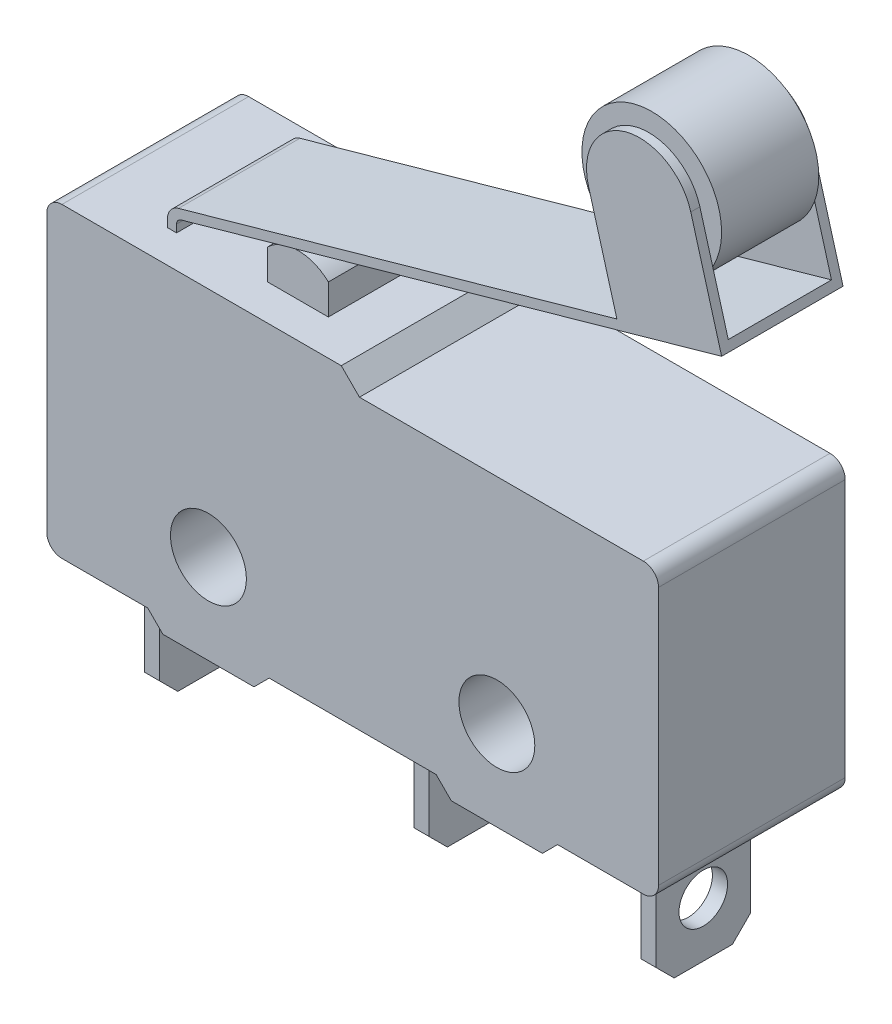
from build123d import *

# Parameters (mm, degrees)
CROQUIS1_W              = 20.15
CROQUIS1_H              = 9.5
SALIENTE_EXTRUIR1_DEPTH = 3.075
SALIENTE_EXTRUIR2_DEPTH = 6.15
CROQUIS2_3_R            = 1.25
CORTAR_EXTRUIR1_DEPTH   = 6.15
SALIENTE_EXTRUIR3_DEPTH = 6.15
CROQUIS4_W              = 0.5
CROQUIS4_H              = 3.12
SALIENTE_EXTRUIR4_DEPTH = 4
CROQUIS5_R              = 0.8
CORTAR_EXTRUIR2_DEPTH   = 21.6499546
REDONDEO1_R             = 0.5
CROQUIS6_W              = 2
CROQUIS6_H              = 1
SALIENTE_EXTRUIR5_DEPTH = 1.9
SALIENTE_EXTRUIR7_DEPTH = 2
SALIENTE_EXTRUIR8_DEPTH = 0.3
CROQUIS9_R              = 2.3
SALIENTE_EXTRUIR9_DEPTH = 1.6


with BuildPart() as part:
    # Croquis1 → Saliente-Extruir1 (new, symmetric)
    with BuildSketch(Plane.XY):
        Rectangle(CROQUIS1_W, CROQUIS1_H)
    extrude(amount=SALIENTE_EXTRUIR1_DEPTH, both=True)

    # Croquis2 → Saliente-Extruir2 (add)
    with BuildSketch(Plane.XY.offset(3.075)):
        Polygon((-2.75, -4.75), (-6.75, -4.75), (-6.25, -5.25), (-3.25, -5.25), align=None)
        Polygon((6.75, -4.75), (2.75, -4.75), (3.25, -5.25), (6.25, -5.25), align=None)
    extrude(amount=-SALIENTE_EXTRUIR2_DEPTH)

    # Croquis2<3> → Cortar-Extruir1 (cut)
    with BuildSketch(Plane.XY.offset(3.075)):
        with Locations((-4.75, -2.3)):
            Circle(CROQUIS2_3_R)
        with Locations((4.75, -2.3)):
            Circle(CROQUIS2_3_R)
    extrude(amount=-CORTAR_EXTRUIR1_DEPTH, mode=Mode.SUBTRACT)

    # Croquis3 → Saliente-Extruir3 (add)
    with BuildSketch(Plane.XY.offset(3.075)):
        Polygon((-10.075, 4.75), (-10.075, 5.35), (-0.375, 5.35), (0.225, 4.75), align=None)
    extrude(amount=-SALIENTE_EXTRUIR3_DEPTH)

    # Croquis4 → Saliente-Extruir4 (add)
    with BuildSketch(Plane.XZ.offset(4.75)):
        with Locations((8.225, 0)):
            Rectangle(CROQUIS4_W, CROQUIS4_H)
        with Locations((-8.125, 0)):
            Rectangle(CROQUIS4_W, CROQUIS4_H)
        with Locations((0.755, 0)):
            Rectangle(CROQUIS4_W, CROQUIS4_H)
    extrude(amount=SALIENTE_EXTRUIR4_DEPTH)

    # Croquis5 → Cortar-Extruir2 (cut, through all)
    with BuildSketch(Plane.ZY.offset(8.375)):
        with Locations((0, -6.95)):
            Circle(CROQUIS5_R)
        Polygon((-1.56, -8.15), (-0.96, -8.75), (-1.56, -8.75), align=None)
        Polygon((1.56, -8.75), (1.56, -8.15), (0.96, -8.75), align=None)
    extrude(amount=-CORTAR_EXTRUIR2_DEPTH, mode=Mode.SUBTRACT)

    # Redondeo1
    redondeo1_edges = [part.edges().sort_by_distance(p)[0] for p in [
        (-10.075, 5.35, 0),
        (10.075, -4.75, 0),
        (-10.075, -4.75, 0),
        (10.075, 4.75, 0),
    ]]
    fillet(redondeo1_edges, radius=REDONDEO1_R)

    # Croquis6 → Saliente-Extruir5 (add, symmetric)
    with BuildSketch(Plane.XY):
        with BuildLine():
            ThreePointArc((-3.975, 6.35), (-2.975, 6.75), (-1.975, 6.35))
            Line((-1.975, 6.35), (-3.975, 6.35))
        make_face()
        with Locations((-2.975, 5.85)):
            Rectangle(CROQUIS6_W, CROQUIS6_H)
    extrude(amount=SALIENTE_EXTRUIR5_DEPTH, both=True)

    # Croquis7 → Saliente-Extruir7 (add, symmetric)
    with BuildSketch(Plane.XY):
        with BuildLine():
            Line((-6.875, 5.35), (-6.875, 5.6))
            ThreePointArc((-6.875, 5.6), (-6.834433546, 5.720751581), (-6.729190556, 5.792518528))
            Line((-6.729190556, 5.792518528), (11.078773292, 10.805144944))
            Line((11.078773292, 10.805144944), (10.997487458, 11.093922737))
            Line((10.997487458, 11.093922737), (-6.81047639, 6.08129632))
            ThreePointArc((-6.81047639, 6.08129632), (-7.073583865, 5.901878954), (-7.175, 5.6))
            Line((-7.175, 5.6), (-7.175, 5.35))
            Line((-7.175, 5.35), (-6.875, 5.35))
        make_face()
    extrude(amount=SALIENTE_EXTRUIR7_DEPTH, both=True)

    # Croquis8 → Saliente-Extruir8 (add)
    with BuildSketch(Plane.XY.offset(2)):
        with BuildLine():
            Line((10.997487458, 11.093922737), (7.628413217, 10.145588009))
            Line((7.628413217, 10.145588009), (6.693626128, 13.466532619))
            ThreePointArc((6.693626128, 13.466532619), (7.903995885, 15.625237103), (10.06270037, 14.414867346))
            Line((10.06270037, 14.414867346), (10.997487458, 11.093922737))
        make_face()
    saliente_extruir8 = extrude(amount=-SALIENTE_EXTRUIR8_DEPTH)

    # Simetría1: Saliente-Extruir8 across plane
    add(saliente_extruir8.mirror(Plane.XY))


with BuildPart() as body_2:
    # Croquis9 → Saliente-Extruir9 (new, symmetric)
    with BuildSketch(Plane.XY):
        with Locations((8.378163249, 13.940699982)):
            Circle(CROQUIS9_R)
    extrude(amount=SALIENTE_EXTRUIR9_DEPTH, both=True)


solid = Compound([part.part, body_2.part])
